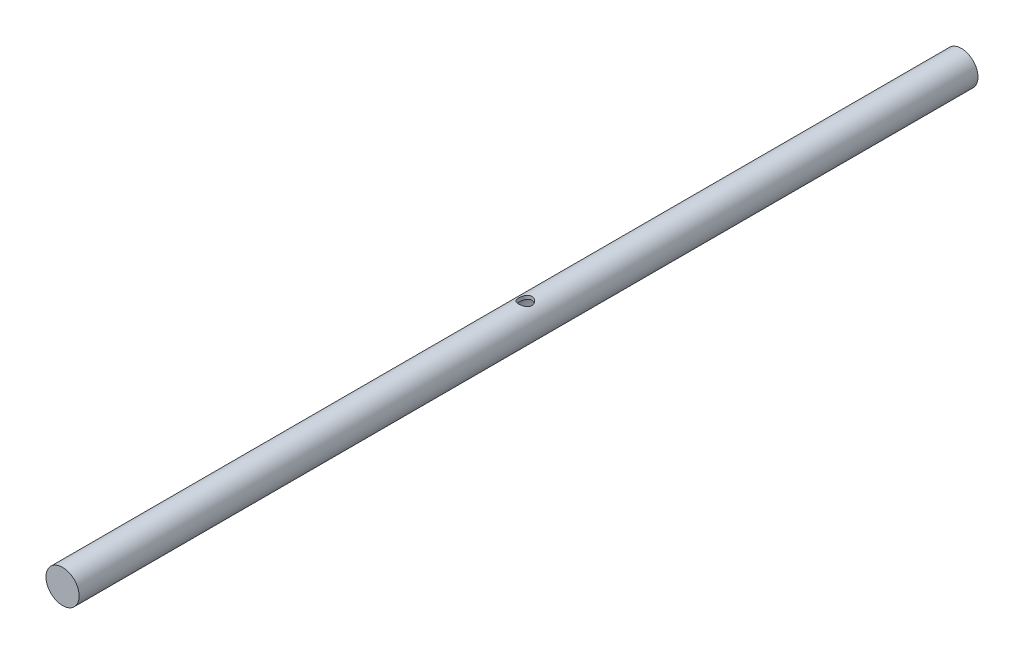
from build123d import *

# Parameters (mm, degrees)
SKETCH1_R           = 3.175
BOSS_EXTRUDE1_DEPTH = 172.085
SHELL1_T            = -0.635
SKETCH3_R           = 1.27
CUT_EXTRUDE3_DEPTH  = 5.08


with BuildPart() as part:
    # Sketch1 → Boss-Extrude1 (new body)
    with BuildSketch(Plane.XY):
        Circle(SKETCH1_R)
    extrude(amount=BOSS_EXTRUDE1_DEPTH)

    # Shell1
    shell1_openings = [part.faces().sort_by_distance(p)[0] for p in [
        (0, 0, 0),
    ]]
    offset(amount=SHELL1_T, openings=shell1_openings, kind=Kind.INTERSECTION)

    # Sketch3 → Cut-Extrude3 (cut)
    with BuildSketch(Plane(origin=(0, 0, 0), x_dir=(1, 0, 0), z_dir=(0, 1, 0))):
        with Locations(Location((0, -83.5025, 0), (0, 0, 90))):
            Circle(SKETCH3_R)
    extrude(amount=CUT_EXTRUDE3_DEPTH, mode=Mode.SUBTRACT)


solid = part.part
